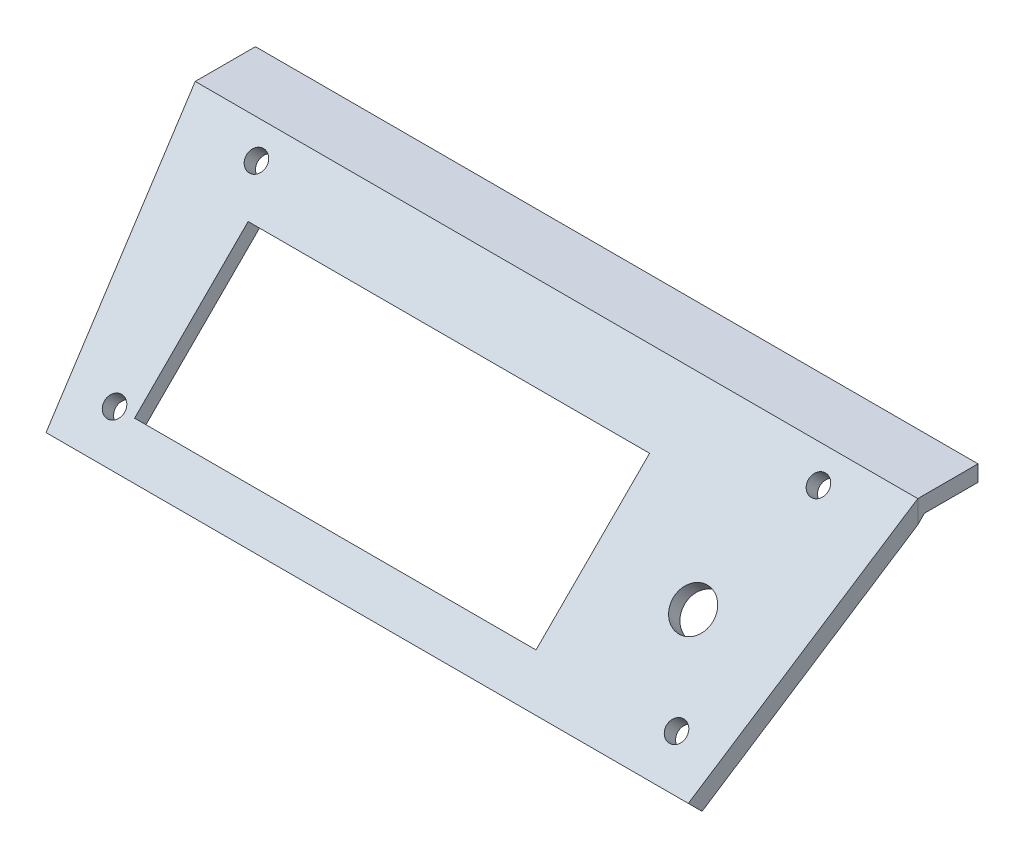
from build123d import *

# Parameters (mm, degrees)
EXTRUDE_1_DEPTH     = 90
CUT_EXTRUDE_1_DEPTH = 160
SKETCH_4_W          = 100
SKETCH_4_H          = 40
CUT_EXTRUDE_2_DEPTH = 102.056914657
SKETCH_5_R          = 5
CUT_EXTRUDE_3_DEPTH = 102.056914657
SKETCH_6_R          = 2.5
CUT_EXTRUDE_4_DEPTH = 102.056914657


with BuildPart() as part:
    # 草圖1 → 填料-伸長1 (new, symmetric)
    with BuildSketch(Plane(origin=(0, 0, 0), x_dir=(0, 0, -1), z_dir=(1, 0, 0))):
        Polygon((-59.343145751, 0), (-13.343145751, 46), (0, 46), (0, 50), (-15, 50), (-62.171572875, 2.828427125), align=None)
    extrude(amount=EXTRUDE_1_DEPTH, both=True)

    # 草圖3 → 除料-伸長1 (cut)
    with BuildSketch(Plane(origin=(0, 0, 0), x_dir=(1, 0, 0), z_dir=(0, 1, 0))):
        Polygon((-90, -15), (-90, -62.171572875), (-80, -62.171572875), align=None)
        Polygon((90, -15), (80, -62.171572875), (90, -62.171572875), align=None)
    extrude(amount=CUT_EXTRUDE_1_DEPTH, mode=Mode.SUBTRACT)

    # 草圖4 → 除料-伸長2 (cut, through all)
    with BuildSketch(Plane(origin=(0, 32.5, 32.5), x_dir=(1, 0, 0), z_dir=(0, 0.7071067811865467, 0.7071067811865485))):
        with Locations((-15, -11.961940777)):
            Rectangle(SKETCH_4_W, SKETCH_4_H)
    extrude(amount=-CUT_EXTRUDE_2_DEPTH, mode=Mode.SUBTRACT)

    # 草圖5 → 除料-伸長3 (cut, through all)
    with BuildSketch(Plane(origin=(0, 32.5, 32.5), x_dir=(1, 0, 0), z_dir=(0, 0.7071067811865467, 0.7071067811865485))):
        with Locations(Location((60, -11.961940777, 0), (0, 0, 270))):
            Circle(SKETCH_5_R)
    extrude(amount=-CUT_EXTRUDE_3_DEPTH, mode=Mode.SUBTRACT)

    # 草圖6 → 除料-伸長4 (cut, through all)
    with BuildSketch(Plane(origin=(0, 32.5, 32.5), x_dir=(1, 0, 0), z_dir=(0, 0.7071067811865467, 0.7071067811865485))):
        with Locations(Location((70, -31.961940777, 0), (0, 0, 270))):
            Circle(SKETCH_6_R)
        with Locations(Location((70, 18.038059223, 0), (0, 0, 270))):
            Circle(SKETCH_6_R)
    cut_extrude_4 = extrude(amount=-CUT_EXTRUDE_4_DEPTH, mode=Mode.SUBTRACT)

    # 鏡射1: 除料-伸長4 across plane
    add(cut_extrude_4.mirror(Plane(origin=(0, 0, 0), x_dir=(0, 0, 1), z_dir=(1, 0, 0))), mode=Mode.SUBTRACT)


solid = part.part
